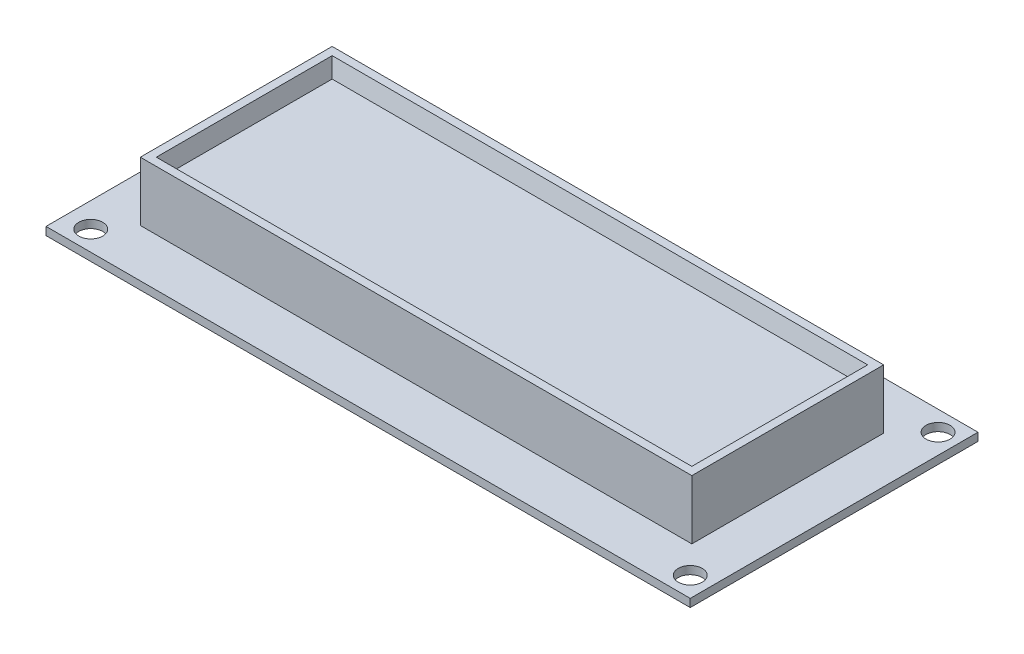
from build123d import *

# Parameters (mm, degrees)
SKETCH1_W           = 80.6
SKETCH1_H           = 36
BOSS_EXTRUDE1_DEPTH = 1
SKETCH2_W           = 69
SKETCH2_H           = 24
BOSS_EXTRUDE2_DEPTH = 7.4
SKETCH3_R           = 1.5
CUT_EXTRUDE1_DEPTH  = 7.4
SKETCH4_W           = 67
SKETCH4_H           = 22
CUT_EXTRUDE2_DEPTH  = 2
CUT_EXTRUDE2_DRAFT  = -15


with BuildPart() as part:
    # Sketch1 → Boss-Extrude1 (new body)
    with BuildSketch(Plane(origin=(0, 0, 0), x_dir=(1, 0, 0), z_dir=(0, 1, 0))):
        with Locations((40.3, 18)):
            Rectangle(SKETCH1_W, SKETCH1_H)
    extrude(amount=BOSS_EXTRUDE1_DEPTH)

    # Sketch2 → Boss-Extrude2 (add)
    with BuildSketch(Plane(origin=(0, 1, 0), x_dir=(1, 0, 0), z_dir=(0, 1, 0))):
        with Locations((40.3, 18)):
            Rectangle(SKETCH2_W, SKETCH2_H)
    extrude(amount=BOSS_EXTRUDE2_DEPTH)

    # Sketch3 → Cut-Extrude1 (cut)
    with BuildSketch(Plane(origin=(0, 1, 0), x_dir=(1, 0, 0), z_dir=(0, 1, 0))):
        with Locations(Location((3.1, 33.5, 0), (0, 0, 270))):
            Circle(SKETCH3_R)
        with Locations(Location((3.1, 2.5, 0), (0, 0, 270))):
            Circle(SKETCH3_R)
        with Locations(Location((78.1, 2.5, 0), (0, 0, 270))):
            Circle(SKETCH3_R)
        with Locations(Location((78.1, 33.5, 0), (0, 0, 270))):
            Circle(SKETCH3_R)
    extrude(amount=-CUT_EXTRUDE1_DEPTH, mode=Mode.SUBTRACT)


with BuildPart() as cut_extrude2_tool:
    # Sketch4 → Cut-Extrude2 (with draft: the straight prism first)
    with BuildSketch(Plane(origin=(0, 8.4, 0), x_dir=(1, 0, 0), z_dir=(0, 1, 0))):
        with Locations((40.3, 18)):
            Rectangle(SKETCH4_W, SKETCH4_H)
    extrude(amount=-CUT_EXTRUDE2_DEPTH)
    # Cut-Extrude2: the draft: its side faces are tilted about the plane it starts from
    cut_extrude2_sides = [cut_extrude2_tool.faces().sort_by_distance(p)[0] for p in [
        (6.8, 7.4, -18),
        (40.3, 7.4, -7),
        (73.8, 7.4, -18),
        (40.3, 7.4, -29),
    ]]
    draft(cut_extrude2_sides, Plane(origin=(0, 8.4, 0), x_dir=(1, 0, 0), z_dir=(0, 1, 0)), CUT_EXTRUDE2_DRAFT)


with BuildPart() as part_1:
    add(part.part)

    # Cut-Extrude2: cut by cut_extrude2_tool
    add(cut_extrude2_tool.part, mode=Mode.SUBTRACT)


solid = part_1.part
